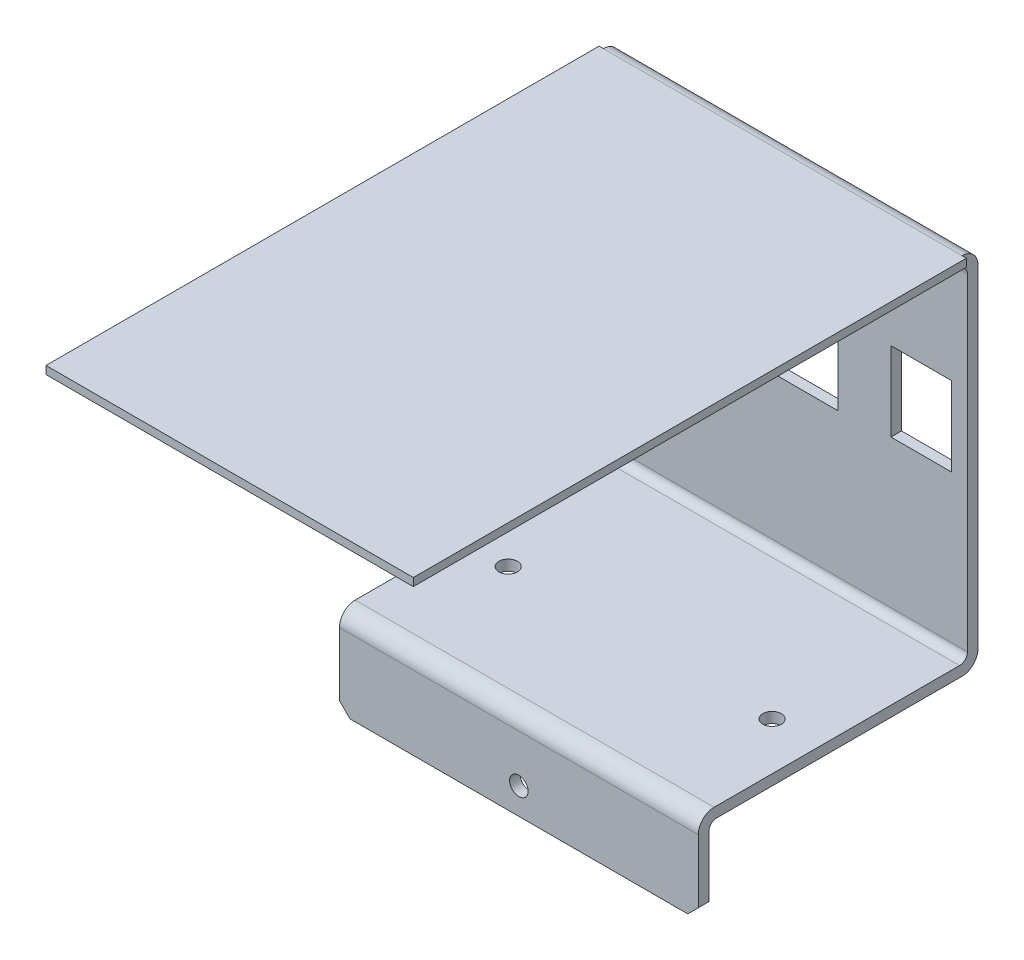
from build123d import *

# Parameters (mm, degrees)
SKETCH1_W           = 68
SKETCH1_H           = 107
BOSS_EXTRUDE1_DEPTH = 2
SKETCH2_W           = 68
SKETCH2_H           = 2
BOSS_EXTRUDE2_DEPTH = 67
CUT_EXTRUDE2_REACH  = 132.744
SKETCH4_W           = 11.5
SKETCH4_H           = 15
SKETCH4_W_2         = 38
SKETCH4_H_2         = 21
SKETCH5_W           = 68
SKETCH5_H           = 2
BOSS_EXTRUDE3_DEPTH = 51
SKETCH6_W           = 68
SKETCH6_H           = 2
BOSS_EXTRUDE4_DEPTH = 15
BOSS_EXTRUDE5_DEPTH = 1.5
CUT_EXTRUDE4_REACH  = 96.449
SKETCH9_R           = 1.75
FILLET1_R           = 1.5
FILLET2_R           = 3
FILLET3_R           = 1.5
FILLET4_R           = 3
FILLET5_R           = 1.5
FILLET6_R           = 3
CUT_EXTRUDE5_REACH  = 106.585
SKETCH10_R          = 1.75
CHAMFER1_SIZE       = 2


with BuildPart() as part:
    # Sketch1 → Boss-Extrude1 (new body)
    with BuildSketch(Plane(origin=(0, 0, 0), x_dir=(1, 0, 0), z_dir=(0, 1, 0))):
        Rectangle(SKETCH1_W, SKETCH1_H)
    extrude(amount=BOSS_EXTRUDE1_DEPTH)

    # Sketch2 → Boss-Extrude2 (add)
    with BuildSketch(Plane.XZ):
        with Locations((0, -52.5)):
            Rectangle(SKETCH2_W, SKETCH2_H)
    extrude(amount=BOSS_EXTRUDE2_DEPTH)

    # Sketch4 → Cut-Extrude2 (cut, up to next)
    with BuildSketch(Plane(origin=(0, 0, -53.5), x_dir=(-1, 0, 0), z_dir=(0, 0, -1)), mode=Mode.PRIVATE) as cut_extrude2_sk1:
        with Locations((-25.25, -28)):
            Rectangle(SKETCH4_W, SKETCH4_H)
    cut_extrude2_tool1 = extrude(cut_extrude2_sk1.sketch, amount=-CUT_EXTRUDE2_REACH, mode=Mode.PRIVATE) & part.part
    # Sketch4 → Cut-Extrude2 (cut, up to next)
    with BuildSketch(Plane(origin=(0, 0, -53.5), x_dir=(-1, 0, 0), z_dir=(0, 0, -1)), mode=Mode.PRIVATE) as cut_extrude2_sk2:
        with Locations((9.546940835, -25.7)):
            Rectangle(SKETCH4_W_2, SKETCH4_H_2)
    cut_extrude2_tool2 = extrude(cut_extrude2_sk2.sketch, amount=-CUT_EXTRUDE2_REACH, mode=Mode.PRIVATE) & part.part
    add(cut_extrude2_tool1.solids().sort_by_distance((25.25, -28, -53.5))[0], mode=Mode.SUBTRACT)
    add(cut_extrude2_tool2.solids().sort_by_distance((-9.546941, -25.7, -53.5))[0], mode=Mode.SUBTRACT)

    # Sketch5 → Boss-Extrude3 (add)
    with BuildSketch(Plane.XY.offset(-51.5)):
        with Locations((0, -66)):
            Rectangle(SKETCH5_W, SKETCH5_H)
    extrude(amount=BOSS_EXTRUDE3_DEPTH)

    # Sketch6 → Boss-Extrude4 (add)
    with BuildSketch(Plane.XZ.offset(67)):
        with Locations((0, -1.5)):
            Rectangle(SKETCH6_W, SKETCH6_H)
    extrude(amount=BOSS_EXTRUDE4_DEPTH)

    # Sketch8 → Boss-Extrude5 (add)
    with BuildSketch(Plane(origin=(0, 2, 0), x_dir=(1, 0, 0), z_dir=(0, 1, 0))):
        Polygon((-34.8, 50.5), (-34, 50.5), (-34, -53.5), (34, -53.5), (34, 50.5), (34.8, 50.5), (34.8, -54.3), (-34.8, -54.3), align=None)
    extrude(amount=-BOSS_EXTRUDE5_DEPTH)

    # Sketch9 → Cut-Extrude4 (cut, up to next)
    with BuildSketch(Plane.XZ.offset(67), mode=Mode.PRIVATE) as cut_extrude4_sk1:
        with Locations(Location((-25, -23.48, 0), (0, 0, 270))):
            Circle(SKETCH9_R)
    cut_extrude4_tool1 = extrude(cut_extrude4_sk1.sketch, amount=-CUT_EXTRUDE4_REACH, mode=Mode.PRIVATE) & part.part
    # Sketch9 → Cut-Extrude4 (cut, up to next)
    with BuildSketch(Plane.XZ.offset(67), mode=Mode.PRIVATE) as cut_extrude4_sk2:
        with Locations(Location((25, -23.48, 0), (0, 0, 270))):
            Circle(SKETCH9_R)
    cut_extrude4_tool2 = extrude(cut_extrude4_sk2.sketch, amount=-CUT_EXTRUDE4_REACH, mode=Mode.PRIVATE) & part.part
    add(cut_extrude4_tool1.solids().sort_by_distance((-25, -67, -23.48))[0], mode=Mode.SUBTRACT)
    add(cut_extrude4_tool2.solids().sort_by_distance((25, -67, -23.48))[0], mode=Mode.SUBTRACT)

    # Fillet1
    fillet1_edges = [part.edges().sort_by_distance(p)[0] for p in [
        (0, -67, -2.5),
    ]]
    fillet(fillet1_edges, radius=FILLET1_R)

    # Fillet2
    fillet2_edges = [part.edges().sort_by_distance(p)[0] for p in [
        (0, -65, -0.5),
    ]]
    fillet(fillet2_edges, radius=FILLET2_R)

    # Fillet3
    fillet3_edges = [part.edges().sort_by_distance(p)[0] for p in [
        (0, -65, -51.5),
    ]]
    fillet(fillet3_edges, radius=FILLET3_R)

    # Fillet4
    fillet4_edges = [part.edges().sort_by_distance(p)[0] for p in [
        (0, -67, -53.5),
    ]]
    fillet(fillet4_edges, radius=FILLET4_R)

    # Fillet5
    fillet5_edges = [part.edges().sort_by_distance(p)[0] for p in [
        (0, 0, -51.5),
    ]]
    fillet(fillet5_edges, radius=FILLET5_R)

    # Fillet6
    fillet6_edges = [part.edges().sort_by_distance(p)[0] for p in [
        (0, 2, -53.5),
    ]]
    fillet(fillet6_edges, radius=FILLET6_R)

    # Sketch10 → Cut-Extrude5 (cut, up to next)
    with BuildSketch(Plane.XY.offset(-0.5), mode=Mode.PRIVATE) as cut_extrude5_sk1:
        with Locations((0, -77)):
            Circle(SKETCH10_R)
    cut_extrude5_tool1 = extrude(cut_extrude5_sk1.sketch, amount=-CUT_EXTRUDE5_REACH, mode=Mode.PRIVATE) & part.part
    add(cut_extrude5_tool1.solids().sort_by_distance((0, -77, -0.5))[0], mode=Mode.SUBTRACT)

    # Chamfer1
    chamfer1_edges = [part.edges().sort_by_distance(p)[0] for p in [
        (-34, -82, -1.5),
        (34, -82, -1.5),
    ]]
    chamfer(chamfer1_edges, length=CHAMFER1_SIZE)


solid = part.part
